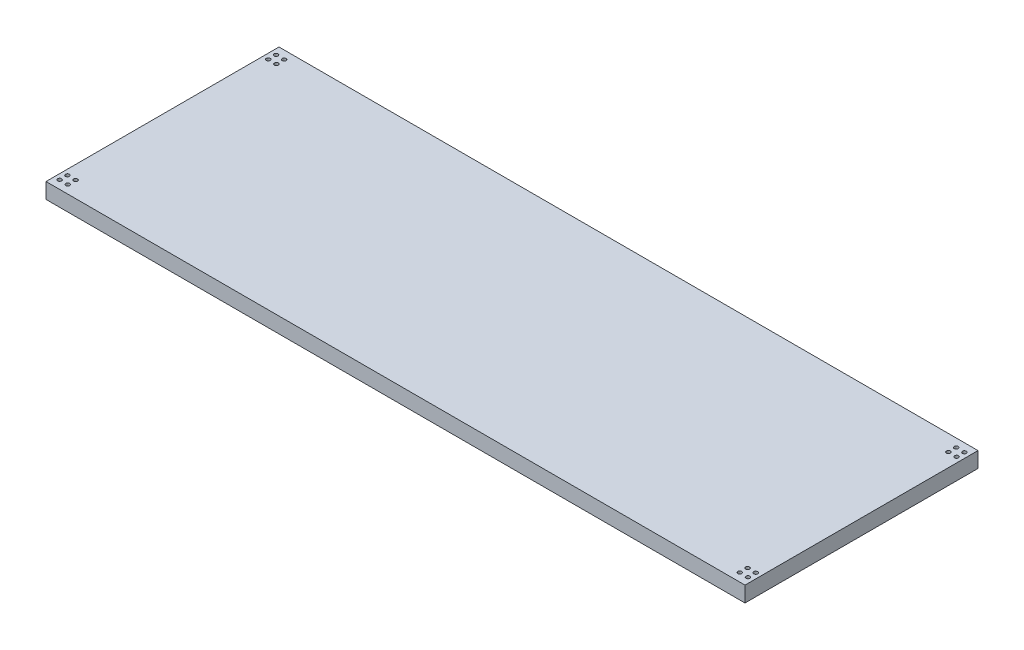
from build123d import *

# Parameters (mm, degrees)
SKETCH2_W           = 1800
SKETCH2_H           = 600
SKETCH2_R           = 5
BOSS_EXTRUDE1_DEPTH = 40


with BuildPart() as part:
    # Sketch2 → Boss-Extrude1 (new body)
    with BuildSketch(Plane(origin=(0, 0, 0), x_dir=(1, 0, 0), z_dir=(0, 1, 0))):
        Rectangle(SKETCH2_W, SKETCH2_H)
        with Locations(Location((-886.27319747, -278.618032202, 0), (0, 0, 270))):
            Circle(SKETCH2_R, mode=Mode.SUBTRACT)
        with Locations(Location((-865.244681744, -278.618032202, 0), (0, 0, 270))):
            Circle(SKETCH2_R, mode=Mode.SUBTRACT)
        with Locations(Location((-865.244681744, -258.618032202, 0), (0, 0, 270))):
            Circle(SKETCH2_R, mode=Mode.SUBTRACT)
        with Locations(Location((-886.27319747, -258.618032202, 0), (0, 0, 270))):
            Circle(SKETCH2_R, mode=Mode.SUBTRACT)
        with Locations(Location((886.27319747, -278.618032202, 0), (0, 0, 90))):
            Circle(SKETCH2_R, mode=Mode.SUBTRACT)
        with Locations(Location((886.27319747, -258.618032202, 0), (0, 0, 90))):
            Circle(SKETCH2_R, mode=Mode.SUBTRACT)
        with Locations(Location((865.244681744, -258.618032202, 0), (0, 0, 90))):
            Circle(SKETCH2_R, mode=Mode.SUBTRACT)
        with Locations(Location((865.244681744, -278.618032202, 0), (0, 0, 90))):
            Circle(SKETCH2_R, mode=Mode.SUBTRACT)
        with Locations(Location((865.244681744, 278.618032202, 0), (0, 0, 270))):
            Circle(SKETCH2_R, mode=Mode.SUBTRACT)
        with Locations(Location((886.27319747, 278.618032202, 0), (0, 0, 270))):
            Circle(SKETCH2_R, mode=Mode.SUBTRACT)
        with Locations(Location((886.27319747, 258.618032202, 0), (0, 0, 270))):
            Circle(SKETCH2_R, mode=Mode.SUBTRACT)
        with Locations(Location((865.244681744, 258.618032202, 0), (0, 0, 270))):
            Circle(SKETCH2_R, mode=Mode.SUBTRACT)
        with Locations(Location((-886.27319747, 278.618032202, 0), (0, 0, 90))):
            Circle(SKETCH2_R, mode=Mode.SUBTRACT)
        with Locations(Location((-865.244681744, 278.618032202, 0), (0, 0, 90))):
            Circle(SKETCH2_R, mode=Mode.SUBTRACT)
        with Locations(Location((-865.244681744, 258.618032202, 0), (0, 0, 90))):
            Circle(SKETCH2_R, mode=Mode.SUBTRACT)
        with Locations(Location((-886.27319747, 258.618032202, 0), (0, 0, 90))):
            Circle(SKETCH2_R, mode=Mode.SUBTRACT)
    extrude(amount=BOSS_EXTRUDE1_DEPTH)


solid = part.part
